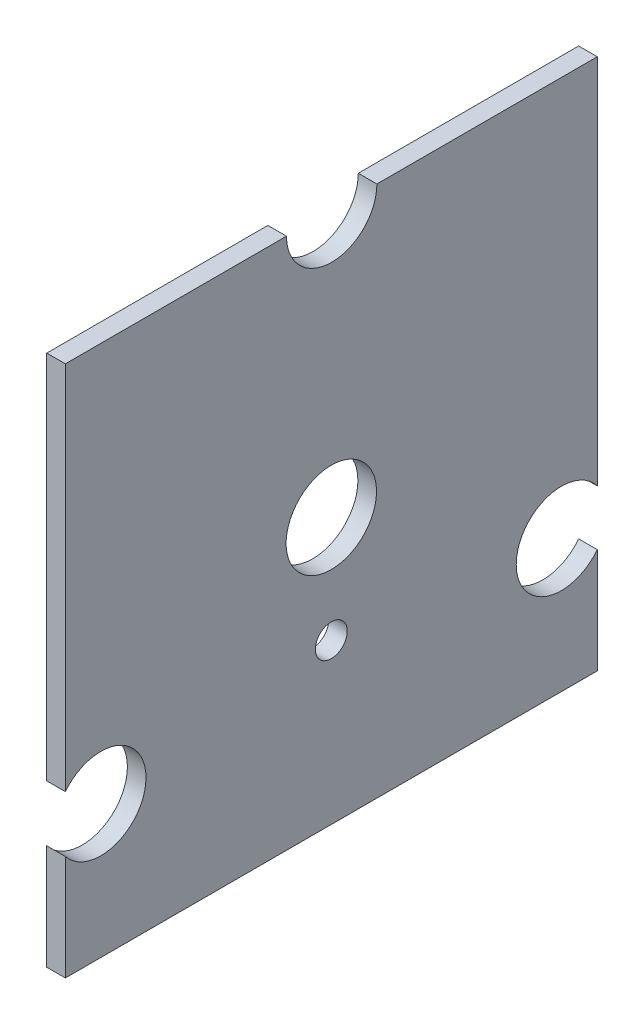
from build123d import *

# Parameters (mm, degrees)
SKETCH2_W           = 100
SKETCH2_H           = 100
SKETCH2_R           = 8.5
BOSS_EXTRUDE1_DEPTH = 3.5
SKETCH3_R           = 8.5
CUT_EXTRUDE1_DEPTH  = 71.797245709
SKETCH4_R           = 3
CUT_EXTRUDE2_DEPTH  = 71.797245709


with BuildPart() as part:
    # Sketch2 → Boss-Extrude1 (new body)
    with BuildSketch(Plane(origin=(0, 0, 0), x_dir=(0, 0, -1), z_dir=(1, 0, 0))):
        Rectangle(SKETCH2_W, SKETCH2_H)
        Circle(SKETCH2_R, mode=Mode.SUBTRACT)
    extrude(amount=BOSS_EXTRUDE1_DEPTH)

    # Sketch3 → Cut-Extrude1 (cut, through all)
    with BuildSketch(Plane.ZY):
        with Locations((43.336976945, -24.938051834)):
            Circle(SKETCH3_R)
        with Locations((-43.265474881, -25.061897041)):
            Circle(SKETCH3_R)
        with Locations((-0.071502064, 49.999948875)):
            Circle(SKETCH3_R)
    extrude(amount=-CUT_EXTRUDE1_DEPTH, mode=Mode.SUBTRACT)

    # Sketch4 → Cut-Extrude2 (cut, through all)
    with BuildSketch(Plane.ZY):
        with Locations((0, -20)):
            Circle(SKETCH4_R)
    extrude(amount=-CUT_EXTRUDE2_DEPTH, mode=Mode.SUBTRACT)


solid = part.part
